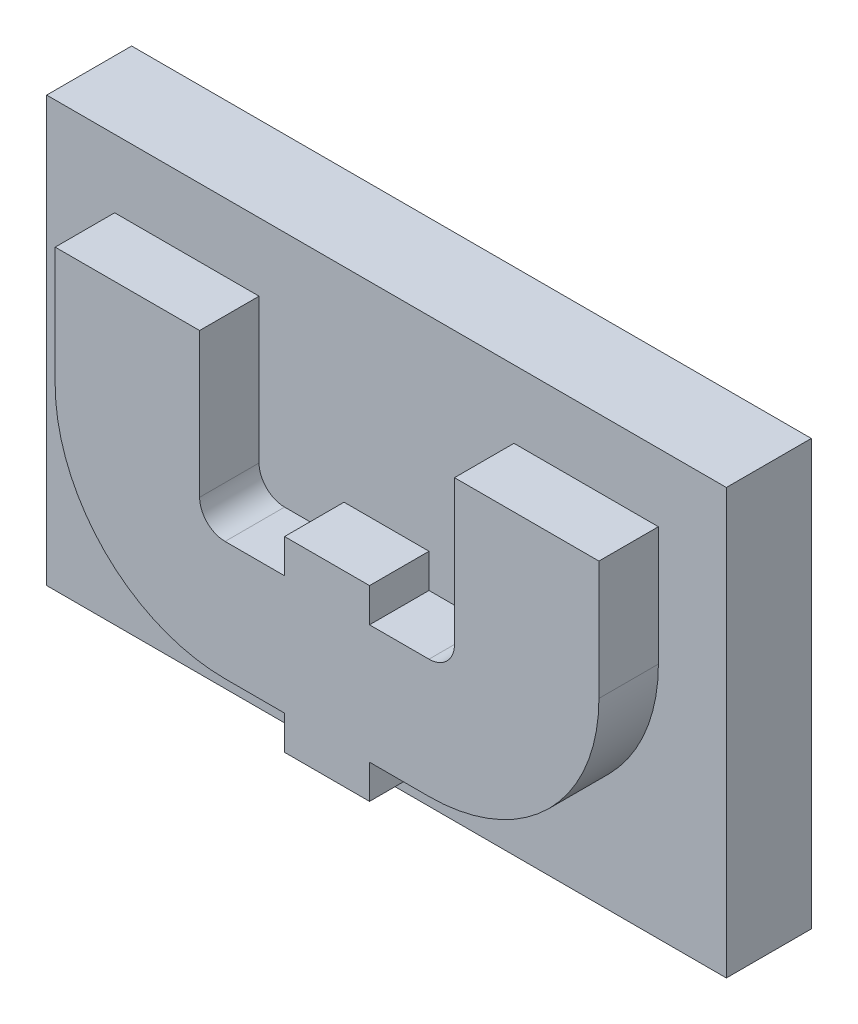
from build123d import *

# Parameters (mm, degrees)
SKETCH1_W           = 80
SKETCH1_H           = 50
BOSS_EXTRUDE1_DEPTH = 10
SKETCH2_W           = 64
SKETCH2_H           = 34
BOSS_EXTRUDE2_DEPTH = 7
FILLET1_R           = 20
SKETCH3_W           = 10
SKETCH3_H           = 7
BOSS_EXTRUDE3_DEPTH = 4
SKETCH4_W           = 30
SKETCH4_H           = 20
CUT_EXTRUDE1_DEPTH  = 7
FILLET2_R           = 3
SKETCH5_W           = 10
SKETCH5_H           = 7
BOSS_EXTRUDE4_DEPTH = 4


with BuildPart() as part:
    # Sketch1 → Boss-Extrude1 (new body)
    with BuildSketch(Plane.XY):
        with Locations((40, 25)):
            Rectangle(SKETCH1_W, SKETCH1_H)
    extrude(amount=BOSS_EXTRUDE1_DEPTH)

    # Sketch2 → Boss-Extrude2 (add)
    with BuildSketch(Plane.XY.offset(10)):
        with Locations((40, 25)):
            Rectangle(SKETCH2_W, SKETCH2_H)
    extrude(amount=BOSS_EXTRUDE2_DEPTH)

    # Fillet1
    fillet1_edges = [part.edges().sort_by_distance(p)[0] for p in [
        (8, 8, 13.5),
        (72, 8, 13.5),
    ]]
    fillet(fillet1_edges, radius=FILLET1_R)

    # Sketch3 → Boss-Extrude3 (add)
    with BuildSketch(Plane(origin=(0, 8, 0), x_dir=(-1, 0, 0), z_dir=(0, -1, 0))):
        with Locations((-40, -13.5)):
            Rectangle(SKETCH3_W, SKETCH3_H)
    extrude(amount=BOSS_EXTRUDE3_DEPTH)

    # Sketch4 → Cut-Extrude1 (cut)
    with BuildSketch(Plane.XY.offset(17)):
        with Locations((40, 32)):
            Rectangle(SKETCH4_W, SKETCH4_H)
    extrude(amount=-CUT_EXTRUDE1_DEPTH, mode=Mode.SUBTRACT)

    # Fillet2
    fillet2_edges = [part.edges().sort_by_distance(p)[0] for p in [
        (55, 22, 13.5),
        (25, 22, 13.5),
    ]]
    fillet(fillet2_edges, radius=FILLET2_R)

    # Sketch5 → Boss-Extrude4 (add)
    with BuildSketch(Plane(origin=(0, 22, 0), x_dir=(1, 0, 0), z_dir=(0, 1, 0))):
        with Locations((40, -13.5)):
            Rectangle(SKETCH5_W, SKETCH5_H)
    extrude(amount=BOSS_EXTRUDE4_DEPTH)


solid = part.part
